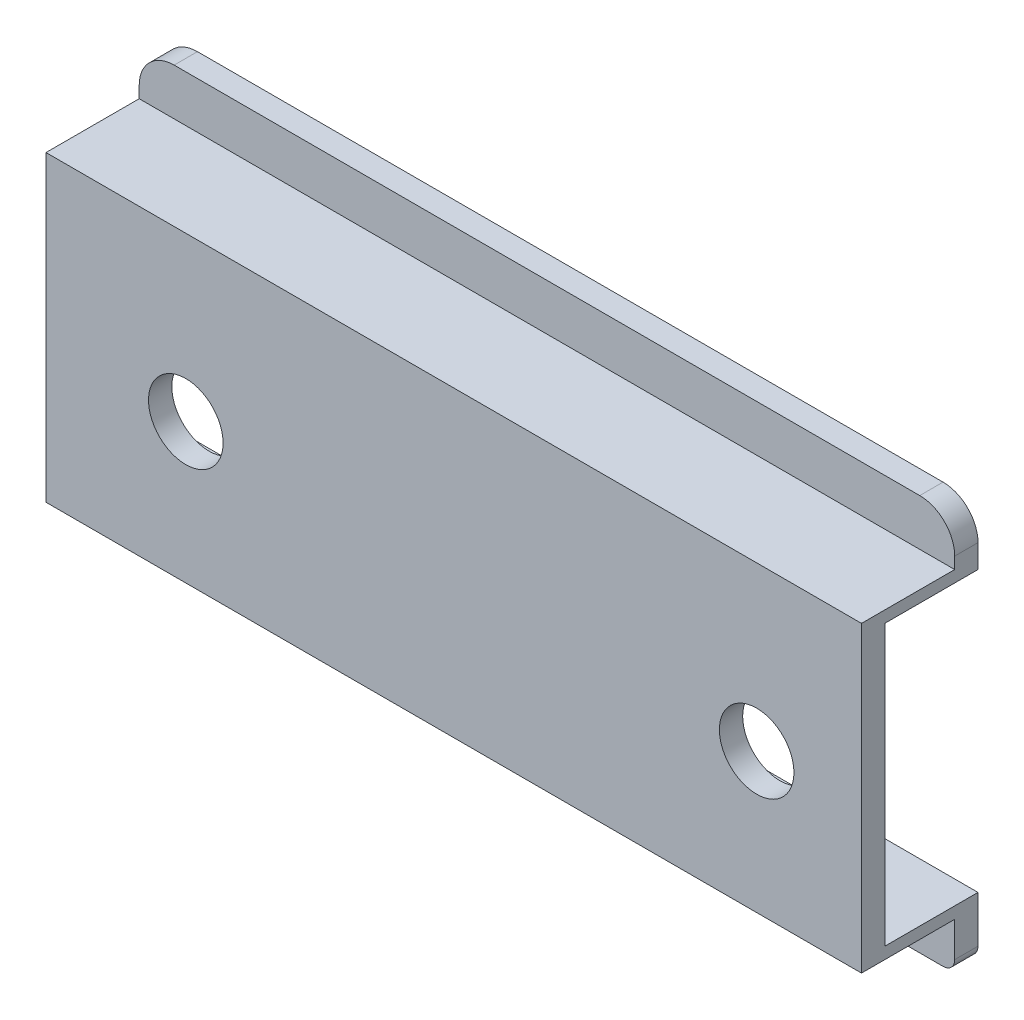
from build123d import *

# Parameters (mm, degrees)
SKETCH_1_W          = 350
SKETCH_1_H          = 170
EXTRUDE_1_DEPTH     = 50
SKETCH_2_W          = 350
SKETCH_2_H          = 20
CUT_EXTRUDE_1_DEPTH = 40
SKETCH_3_W          = 350
SKETCH_3_H          = 120
CUT_EXTRUDE_2_DEPTH = 40
SKETCH_4_R          = 16
CUT_EXTRUDE_3_DEPTH = 227.34896931
FILLET_1_R          = 5
FILLET_2_R          = 5
FILLET_3_R          = 15
FILLET_4_R          = 15


with BuildPart() as part:
    # 草图1 → 凸台-拉伸1 (new body)
    with BuildSketch(Plane.XY):
        with Locations((11.189258312, 33.606138107)):
            Rectangle(SKETCH_1_W, SKETCH_1_H)
    extrude(amount=EXTRUDE_1_DEPTH)

    # 草图2 → 切除-拉伸1 (cut)
    with BuildSketch(Plane.XY.offset(50)):
        with Locations((11.189258312, -41.393861893)):
            Rectangle(SKETCH_2_W, SKETCH_2_H)
        with Locations((11.189258312, 108.606138107)):
            Rectangle(SKETCH_2_W, SKETCH_2_H)
    extrude(amount=-CUT_EXTRUDE_1_DEPTH, mode=Mode.SUBTRACT)

    # 草图3 → 切除-拉伸2 (cut)
    with BuildSketch(Plane(origin=(0, 0, 0), x_dir=(-1, 0, 0), z_dir=(0, 0, -1))):
        with Locations((-11.189258312, 33.606138107)):
            Rectangle(SKETCH_3_W, SKETCH_3_H)
    extrude(amount=-CUT_EXTRUDE_2_DEPTH, mode=Mode.SUBTRACT)

    # 草图4 → 切除-拉伸3 (cut, through all)
    with BuildSketch(Plane.XY.offset(50)):
        with Locations((-103.810741688, 28.606138107)):
            Circle(SKETCH_4_R)
        with Locations((141.189258312, 28.606138107)):
            Circle(SKETCH_4_R)
    extrude(amount=-CUT_EXTRUDE_3_DEPTH, mode=Mode.SUBTRACT)

    # 圆角1
    fillet_1_edges = [part.edges().sort_by_distance(p)[0] for p in [
        (-163.810741688, -51.393861893, 5),
    ]]
    fillet(fillet_1_edges, radius=FILLET_1_R)

    # 圆角2
    fillet_2_edges = [part.edges().sort_by_distance(p)[0] for p in [
        (186.189258312, -51.393861893, 5),
    ]]
    fillet(fillet_2_edges, radius=FILLET_2_R)

    # 圆角3
    fillet_3_edges = [part.edges().sort_by_distance(p)[0] for p in [
        (186.189258312, 118.606138107, 5),
    ]]
    fillet(fillet_3_edges, radius=FILLET_3_R)

    # 圆角4
    fillet_4_edges = [part.edges().sort_by_distance(p)[0] for p in [
        (-163.810741688, 118.606138107, 5),
    ]]
    fillet(fillet_4_edges, radius=FILLET_4_R)


solid = part.part
